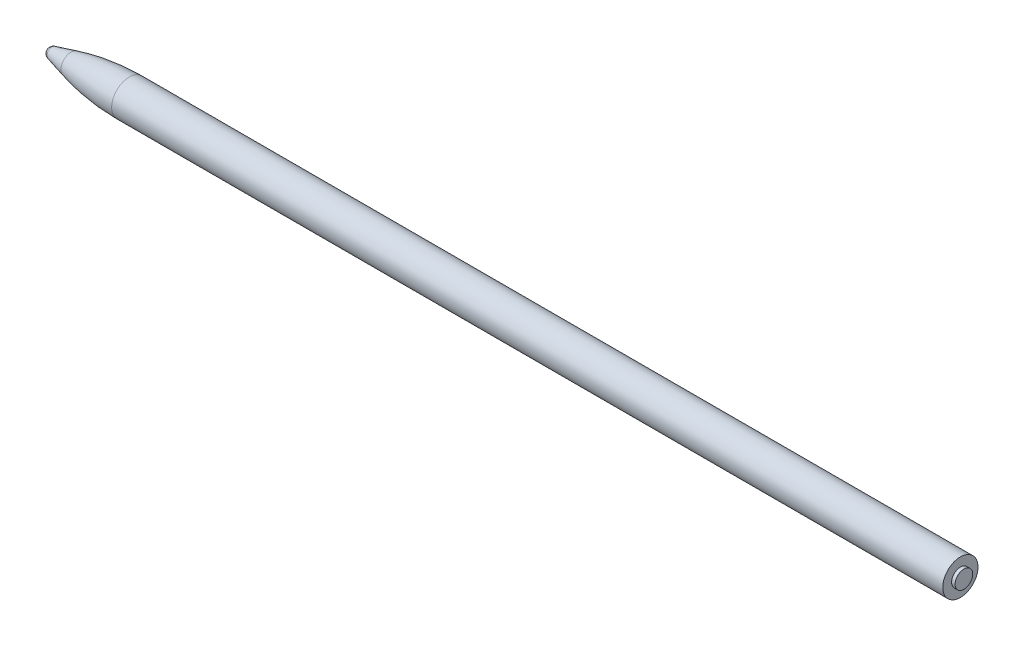
from build123d import *


with BuildPart() as part:
    # 草图1 → 旋转1 (revolve)
    with BuildSketch(Plane.XY):
        with BuildLine():
            Line((0, 0), (0, 0.5))
            Line((0, 0.5), (-0.2, 0.5))
            Line((-0.2, 0.5), (-0.2, 1))
            Line((-0.2, 1), (-47.395544162, 1))
            ThreePointArc((-47.395544162, 1), (-49.061508534, 0.892810505), (-50.7, 0.573009648))
            Line((-50.7, 0.573009648), (-51.776256673, 0.290146377))
            ThreePointArc((-51.776256673, 0.290146377), (-51.937567887, 0.183197978), (-52, 0))
            Line((-52, 0), (0, 0))
        make_face()
    revolve(axis=Axis((0, 0, 0), (-1, 0, 0)))


solid = part.part
